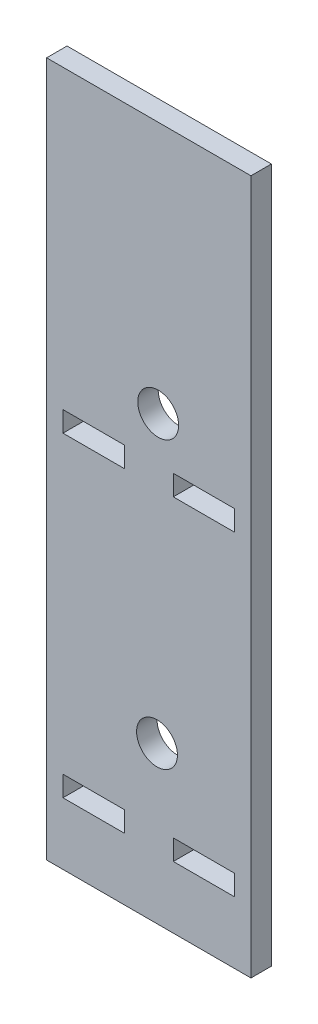
from build123d import *

# Parameters (mm, degrees)
SKETCH1_W           = 50
SKETCH1_H           = 170
SKETCH1_R           = 5
SKETCH1_W_2         = 15
SKETCH1_H_2         = 5
BOSS_EXTRUDE1_DEPTH = 5


with BuildPart() as part:
    # Sketch1 → Boss-Extrude1 (new body)
    with BuildSketch(Plane.XY):
        with Locations((-17.719310928, 76.759780871)):
            Rectangle(SKETCH1_W, SKETCH1_H)
        with Locations((-15.705505676, 29.999739242)):
            Circle(SKETCH1_R, mode=Mode.SUBTRACT)
        with Locations((-15.413646235, 99.999739242)):
            Circle(SKETCH1_R, mode=Mode.SUBTRACT)
        with Locations((-31.219310928, 9.449835726)):
            Rectangle(SKETCH1_W_2, SKETCH1_H_2, mode=Mode.SUBTRACT)
        with Locations((-31.219310928, 86.716581053)):
            Rectangle(SKETCH1_W_2, SKETCH1_H_2, mode=Mode.SUBTRACT)
        with Locations((-4.219310928, 86.716581053)):
            Rectangle(SKETCH1_W_2, SKETCH1_H_2, mode=Mode.SUBTRACT)
        with Locations((-4.219310928, 9.449835726)):
            Rectangle(SKETCH1_W_2, SKETCH1_H_2, mode=Mode.SUBTRACT)
    extrude(amount=BOSS_EXTRUDE1_DEPTH)


solid = part.part
